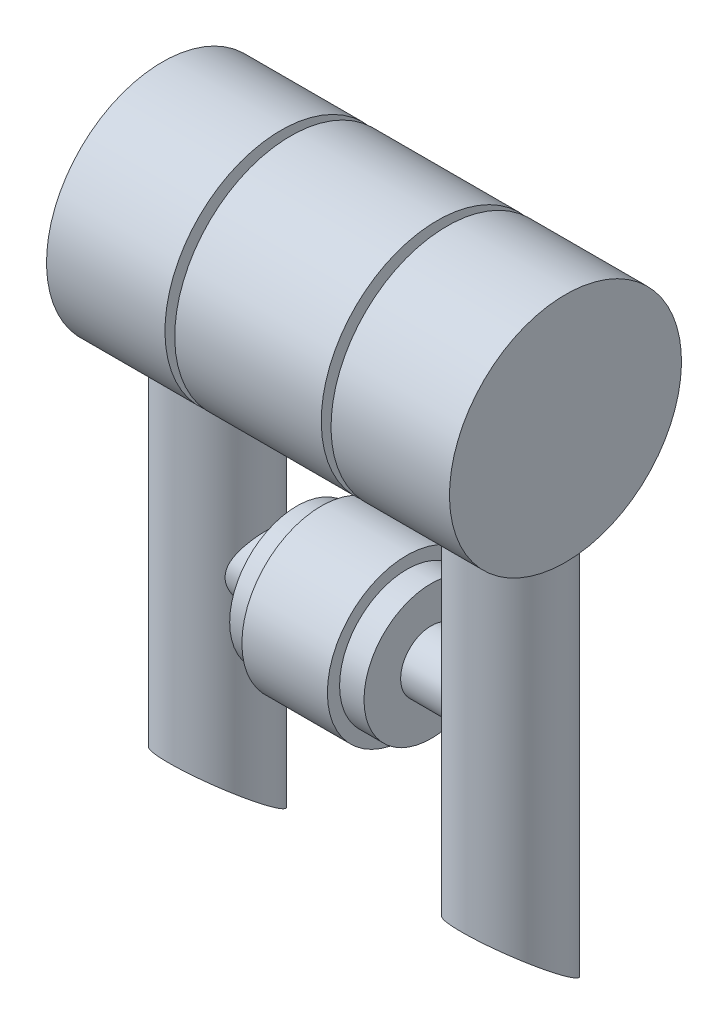
from build123d import *

# Parameters (mm, degrees)
SKETCH_5_R               = 4
EXTRUDE_3_DEPTH          = 42
CUT_EXTRUDE_2_DEPTH      = 47.113989348
CUT_EXTRUDE_2_DEPTH_BACK = 47.113989348
EXTRUDE_4_DEPTH          = 12
EXTRUDE_4_DEPTH_BACK     = 12
SKETCH_7_R               = 2.5


with BuildPart() as part:
    # Эскиз4 → Повернуть1 (revolve)
    with BuildSketch(Plane.XY, mode=Mode.PRIVATE) as revolve_1_sk:
        Polygon((-16.5, 0), (-16.5, 9.5), (-6.8, 9.5), (-6.8, 8), (-6, 8), (-6, 9.5), (6, 9.5), (6, 8), (6.8, 8), (6.8, 9.5), (16.5, 9.5), (16.5, 0), align=None)
    revolve(revolve_1_sk.sketch.rotate(Axis((-16.5, 0, 0), (1, 0, 0)), 180), axis=Axis((-16.5, 0, 0), (1, 0, 0)))

    # Эскиз5 → Бобышка-Вытянуть3 (add)
    with BuildSketch(Plane(origin=(0, 0, 0), x_dir=(1, 0, 0), z_dir=(0, 1, 0))):
        with Locations(Location((-12, 0, 0), (0, 0, 270))):
            Circle(SKETCH_5_R)
        with Locations(Location((12, 0, 0), (0, 0, 270))):
            Circle(SKETCH_5_R)
    extrude(amount=-EXTRUDE_3_DEPTH)

    # Эскиз6 → Вырез-Вытянуть2 (cut, two sides: drawn at the far end of the back side and taken through both)
    with BuildSketch(Plane(origin=(0, 0, 0), x_dir=(0, 0, -1), z_dir=(1, 0, 0)).offset(-CUT_EXTRUDE_2_DEPTH_BACK)):
        Polygon((4, -42), (-4, -35.971567599), (-4, -42), align=None)
    extrude(amount=CUT_EXTRUDE_2_DEPTH + CUT_EXTRUDE_2_DEPTH_BACK, mode=Mode.SUBTRACT)

    # Эскиз7 → Бобышка-Вытянуть4 (add, two sides: drawn at the far end of the back side and taken through both)
    with BuildSketch(Plane(origin=(0, 0, 0), x_dir=(0, 0, -1), z_dir=(1, 0, 0)).offset(-EXTRUDE_4_DEPTH_BACK)):
        with Locations((0, -22)):
            Circle(SKETCH_7_R)
    extrude(amount=EXTRUDE_4_DEPTH + EXTRUDE_4_DEPTH_BACK)

    # Эскиз8 → Повернуть2 (revolve)
    with BuildSketch(Plane.XY, mode=Mode.PRIVATE) as revolve_2_sk:
        Polygon((-5.5, -22), (-5.5, -16.5), (-3.5, -16.5), (-3.5, -15.5), (3.5, -15.5), (3.5, -16.5), (5.5, -16.5), (5.5, -22), align=None)
    revolve(revolve_2_sk.sketch.rotate(Axis((-20.226487352, -22, 0), (1, 0, 0)), 90), axis=Axis((-20.226487352, -22, 0), (1, 0, 0)))


solid = part.part
